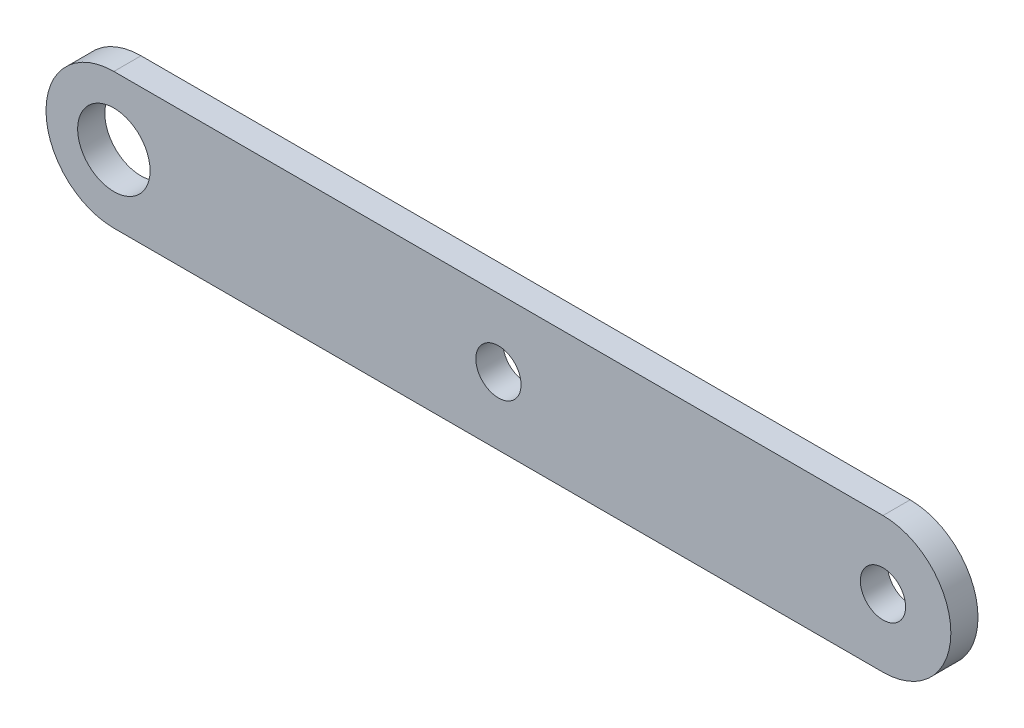
from build123d import *

# Parameters (mm, degrees)
SKETCH_1_R      = 4
SKETCH_1_R_2    = 2.5
EXTRUDE_1_DEPTH = 3


with BuildPart() as part:
    # 草图1 → 凸台-拉伸1 (new body)
    with BuildSketch(Plane.XY):
        with BuildLine():
            Line((-42.5, -7.5), (42.5, -7.5))
            ThreePointArc((42.5, -7.5), (50, 0), (42.5, 7.5))
            Line((42.5, 7.5), (-42.5, 7.5))
            ThreePointArc((-42.5, 7.5), (-50, 0), (-42.5, -7.5))
        make_face()
        with Locations((-42.5, 0)):
            Circle(SKETCH_1_R, mode=Mode.SUBTRACT)
        with Locations((42.5, 0)):
            Circle(SKETCH_1_R_2, mode=Mode.SUBTRACT)
        Circle(SKETCH_1_R_2, mode=Mode.SUBTRACT)
    extrude(amount=EXTRUDE_1_DEPTH)


solid = part.part
